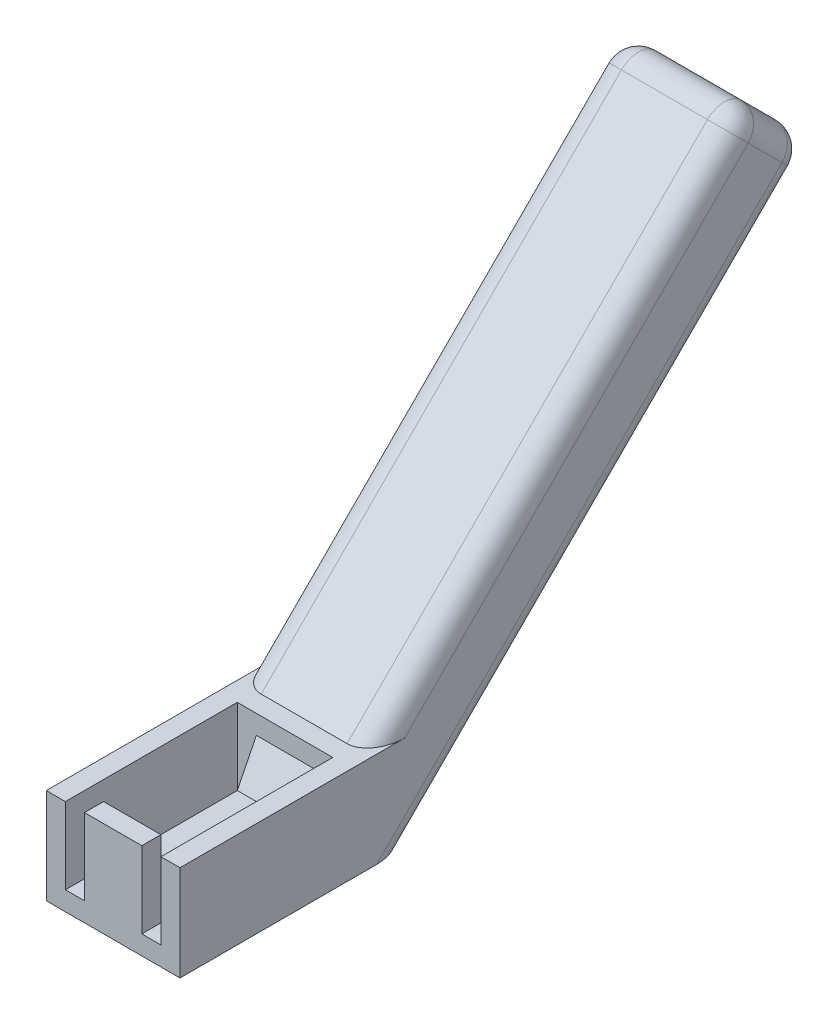
from build123d import *

# Parameters (mm, degrees)
BOSS_EXTRUDE1_DEPTH      = 8.75
BOSS_EXTRUDE1_DEPTH_BACK = 8.75
BOSS_EXTRUDE2_REACH      = 83.958
SKETCH2_W                = 2.5
SKETCH2_H                = 12.5
CUT_EXTRUDE1_START       = 2.5
SKETCH3_W                = 2.5
SKETCH3_H                = 22.5
CUT_EXTRUDE1_DEPTH       = 80.458449839
FILLET1_R                = 3.125


with BuildPart() as part:
    # Sketch1 → Boss-Extrude1 (new, two sides: drawn at the far end of the back side and taken through both)
    with BuildSketch(Plane(origin=(0, 0, 0), x_dir=(0, 0, -1), z_dir=(1, 0, 0)).offset(-BOSS_EXTRUDE1_DEPTH_BACK)):
        Polygon((-27.67766953, 2.5), (-27.67766953, 5), (-25.17766953, 5), (-27.67766953, 10), (-27.67766953, 12.5), (-30.17766953, 12.5), (-30.17766953, 0), (0, 0), (53.033008589, 53.033008589), (44.194173824, 61.871843354), (-5.17766953, 12.5), (-7.67766953, 12.5), (-7.67766953, 10), (-10.17766953, 5), (-7.67766953, 5), (-7.67766953, 2.5), align=None)
    extrude(amount=BOSS_EXTRUDE1_DEPTH + BOSS_EXTRUDE1_DEPTH_BACK)

    # Boss-Extrude2: up to this face of the body (flat: up to its plane)
    boss_extrude2_end = Plane(part.part.faces().sort_by_distance((0, 6.25, 30.17766953))[0])
    # Sketch2 → Boss-Extrude2 (add, up to the picked face)
    with BuildSketch(Plane.XY, mode=Mode.PRIVATE) as boss_extrude2_sk1:
        with Locations((-7.5, 6.25)):
            Rectangle(SKETCH2_W, SKETCH2_H)
    boss_extrude2_tool1 = split(extrude(boss_extrude2_sk1.sketch, amount=BOSS_EXTRUDE2_REACH, mode=Mode.PRIVATE), bisect_by=boss_extrude2_end, keep=Keep.BOTH, mode=Mode.PRIVATE)
    # Sketch2 → Boss-Extrude2 (add, up to the picked face)
    with BuildSketch(Plane.XY, mode=Mode.PRIVATE) as boss_extrude2_sk2:
        with Locations((7.5, 6.25)):
            Rectangle(SKETCH2_W, SKETCH2_H)
    boss_extrude2_tool2 = split(extrude(boss_extrude2_sk2.sketch, amount=BOSS_EXTRUDE2_REACH, mode=Mode.PRIVATE), bisect_by=boss_extrude2_end, keep=Keep.BOTH, mode=Mode.PRIVATE)
    add(boss_extrude2_tool1.solids().sort_by(Axis((-7.5, 6.25, 0), (0, 0, 1)))[0])
    add(boss_extrude2_tool2.solids().sort_by(Axis((7.5, 6.25, 0), (0, 0, 1)))[0])

    # Sketch3 → Cut-Extrude1 (cut, through all)
    with BuildSketch(Plane(origin=(0, 0, 0), x_dir=(1, 0, 0), z_dir=(0, 1, 0)).offset(CUT_EXTRUDE1_START)):
        with Locations((-5, -18.92766953)):
            Rectangle(SKETCH3_W, SKETCH3_H)
        with Locations((5, -18.92766953)):
            Rectangle(SKETCH3_W, SKETCH3_H)
    extrude(amount=CUT_EXTRUDE1_DEPTH, mode=Mode.SUBTRACT)

    # Fillet1
    fillet1_edges = [part.edges().sort_by_distance(p)[0] for p in [
        (0, 61.871843354, -44.194173824),
        (0, 53.033008589, -53.033008589),
        (-8.75, 26.516504294, -26.516504294),
        (-8.75, 57.452425971, -48.613591207),
        (-8.75, 37.185921677, -19.508252147),
        (8.75, 26.516504294, -26.516504294),
        (8.75, 57.452425971, -48.613591207),
        (8.75, 37.185921677, -19.508252147),
    ]]
    fillet(fillet1_edges, radius=FILLET1_R)


solid = part.part
